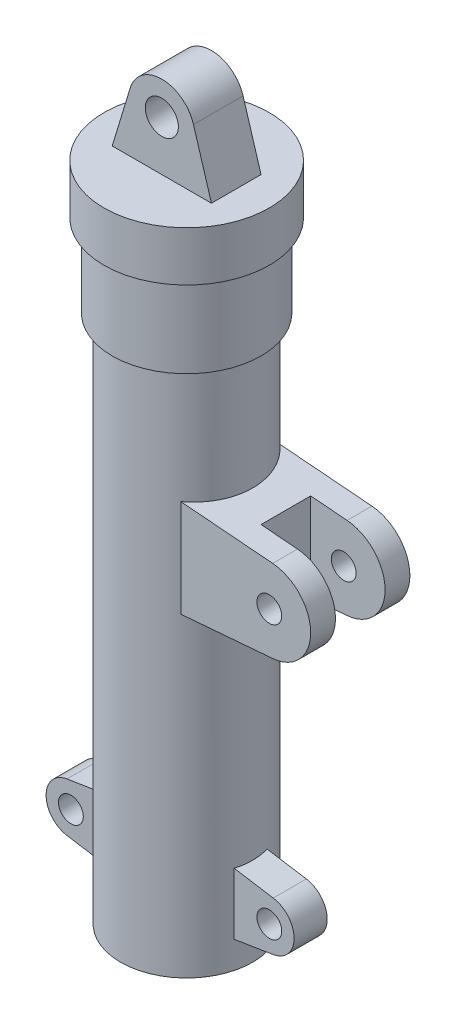
from build123d import *

# Parameters (mm, degrees)
SKETCH2_R           = 10
BOSS_EXTRUDE1_DEPTH = 15
SKETCH3_R           = 7.5
BOSS_EXTRUDE2_DEPTH = 10
SKETCH8_R           = 7.5
BOSS_EXTRUDE3_DEPTH = 30
SKETCH4_W           = 35
SKETCH4_H           = 315
SKETCH9_W           = 70
SKETCH9_H           = 80
CUT_EXTRUDE1_DEPTH  = 15


with BuildPart() as part:
    # Sketch1 → Base-Revolve (revolve)
    with BuildSketch(Plane.XY, mode=Mode.PRIVATE) as base_revolve_sk:
        Polygon((22.5, -330), (40, -330), (40, -10), (45, -10), (45, 40), (50, 40), (50, 70), (0, 70), (0, 55), (35, 55), (35, -325), (22.5, -325), align=None)
    revolve(base_revolve_sk.sketch.rotate(Axis((0, 100, 0), (0, -1, 0)), 90), axis=Axis((0, 100, 0), (0, -1, 0)))

    # Sketch2 → Boss-Extrude1 (add, symmetric)
    with BuildSketch(Plane.XY):
        with BuildLine():
            Line((19.138857956, 105.805524623), (30, 70))
            Line((30, 70), (-30, 70))
            Line((-30, 70), (-19.138857956, 105.805524623))
            ThreePointArc((-19.138857956, 105.805524623), (0, 120), (19.138857956, 105.805524623))
        make_face()
        with Locations((0, 100)):
            Circle(SKETCH2_R, mode=Mode.SUBTRACT)
    extrude(amount=BOSS_EXTRUDE1_DEPTH, both=True)

    # Sketch3 → Boss-Extrude2 (add, symmetric)
    with BuildSketch(Plane.XY):
        with BuildLine():
            Line((62.373967528, -280.189048708), (30, -275))
            Line((30, -275), (30, -315))
            Line((30, -315), (62.373967528, -309.810951292))
            ThreePointArc((62.373967528, -309.810951292), (75, -295), (62.373967528, -280.189048708))
        make_face()
        with Locations((60, -295)):
            Circle(SKETCH3_R, mode=Mode.SUBTRACT)
    boss_extrude2 = extrude(amount=BOSS_EXTRUDE2_DEPTH, both=True)

    # Mirror1: Boss-Extrude2 across plane
    add(boss_extrude2.mirror(Plane(origin=(0, 0, 0), x_dir=(0, 0, 1), z_dir=(1, 0, 0))))

    # Sketch8 → Boss-Extrude3 (add, symmetric)
    with BuildSketch(Plane.XY):
        with BuildLine():
            Line((82.041582998, -85.08350067), (20, -80))
            Line((20, -80), (20, -140))
            Line((20, -140), (82.041582998, -134.91649933))
            ThreePointArc((82.041582998, -134.91649933), (105, -110), (82.041582998, -85.08350067))
        make_face()
        with Locations(Location((80, -110, 0), (0, 0, 180))):
            Circle(SKETCH8_R, mode=Mode.SUBTRACT)
    extrude(amount=BOSS_EXTRUDE3_DEPTH, both=True)

    # Sketch4 → Cut-Revolve1 (revolve, cut)
    with BuildSketch(Plane.XY):
        with Locations((17.5, -167.5)):
            Rectangle(SKETCH4_W, SKETCH4_H)
    revolve(axis=Axis((0, 0, 0), (0, -1, 0)), mode=Mode.SUBTRACT)

    # Sketch9 → Cut-Extrude1 (cut, symmetric)
    with BuildSketch(Plane.XY):
        with Locations((95, -110)):
            Rectangle(SKETCH9_W, SKETCH9_H)
    extrude(amount=CUT_EXTRUDE1_DEPTH, both=True, mode=Mode.SUBTRACT)


solid = part.part
